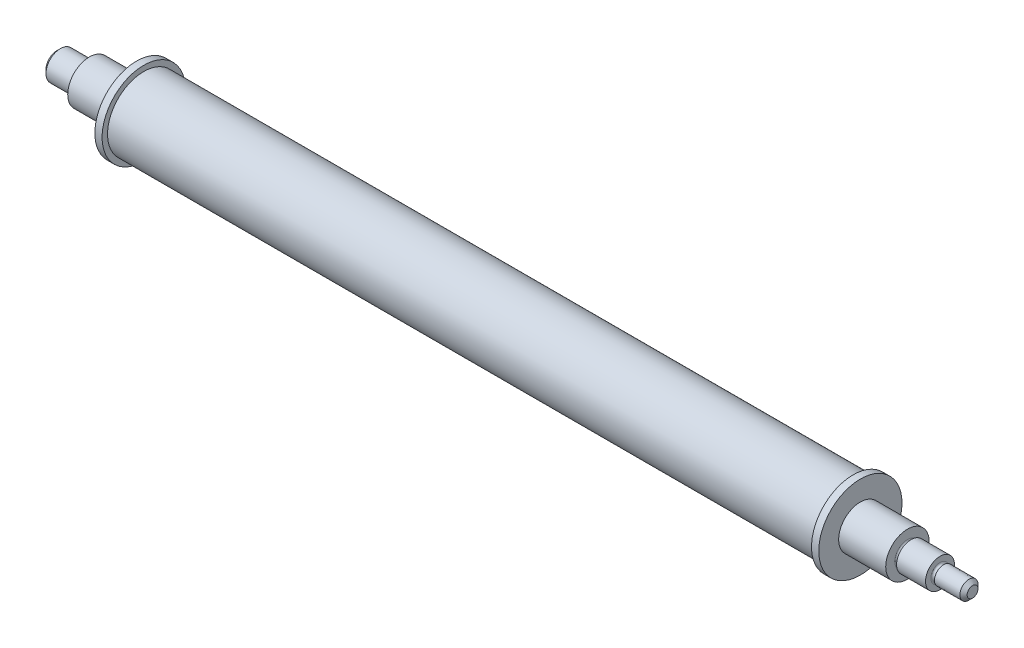
from build123d import *

# Parameters (mm, degrees)
SKETCH2_R           = 10
BOSS_EXTRUDE1_DEPTH = 98
SKETCH11_R          = 11.5
BOSS_EXTRUDE3_DEPTH = 2
CHAMFER2_SIZE       = 1
CHAMFER2_SIZE2      = 1.002948478
SKETCH15_R          = 2.523484115
CUT_EXTRUDE2_DEPTH  = 9
CHAMFER4_SIZE       = 1


with BuildPart() as part:
    # Sketch2 → Boss-Extrude1 (new body)
    with BuildSketch(Plane(origin=(0, 0, 0), x_dir=(0, 0, -1), z_dir=(1, 0, 0))):
        Circle(SKETCH2_R)
    extrude(amount=BOSS_EXTRUDE1_DEPTH)

    # Sketch11 → Boss-Extrude3 (add)
    with BuildSketch(Plane(origin=(98, 0, 0), x_dir=(0, 0, -1), z_dir=(1, 0, 0))):
        Circle(SKETCH11_R)
    extrude(amount=BOSS_EXTRUDE3_DEPTH)

    # Mirror3: part across plane


with BuildPart() as part_1:
    add(part.part)
    add(part.part.mirror(Plane(origin=(0, 0, 0), x_dir=(0, 0, 1), z_dir=(1, 0, 0))))

    # Sketch14 → Revolve1 (revolve)
    with BuildSketch(Plane.XY, mode=Mode.PRIVATE) as revolve1_sk:
        with BuildLine():
            Line((100, 6), (100, 0))
            Line((100, 0), (131, 0))
            Line((131, 0), (131, 2.5))
            Line((131, 2.5), (123, 2.523484115))
            ThreePointArc((123, 2.523484115), (122.853553391, 2.169930724), (122.5, 2.023484115))
            ThreePointArc((122.5, 2.023484115), (122.146446609, 2.169930724), (122, 2.523484115))
            Line((122, 2.523484115), (122, 3))
            Line((122, 3), (122, 4))
            Line((122, 4), (114.5, 4))
            Line((114.5, 4), (114, 4))
            Line((114, 4), (114, 3.5))
            ThreePointArc((114, 3.5), (113.853553391, 3.146446609), (113.5, 3))
            ThreePointArc((113.5, 3), (113.146446609, 3.146446609), (113, 3.5))
            Line((113, 3.5), (113, 6))
            Line((113, 6), (100, 6))
        make_face()
    revolve1 = revolve(revolve1_sk.sketch.rotate(Axis((0, 0, 0), (1, 0, 0)), 90), axis=Axis((0, 0, 0), (1, 0, 0)))

    # Chamfer2
    chamfer2_edges = [part_1.edges().sort_by_distance(p)[0] for p in [
        (131, 0, -2.5),
    ]]
    chamfer2_side = [part_1.faces().sort_by_distance(p)[0] for p in [
        (131, 0, 0),
    ]]
    chamfer(chamfer2_edges, length=CHAMFER2_SIZE, length2=CHAMFER2_SIZE2, reference=chamfer2_side[0])

    # Mirror6: Revolve1 across plane
    add(revolve1.mirror(Plane(origin=(0, 0, 0), x_dir=(0, 0, 1), z_dir=(1, 0, 0))))

    # Sketch15 → Cut-Extrude2 (cut)
    with BuildSketch(Plane.ZY.offset(131)):
        Circle(SKETCH15_R)
    extrude(amount=-CUT_EXTRUDE2_DEPTH, mode=Mode.SUBTRACT)

    # Chamfer4
    chamfer4_edges = [part_1.edges().sort_by_distance(p)[0] for p in [
        (-122, 0, -4),
    ]]
    chamfer(chamfer4_edges, length=CHAMFER4_SIZE)


solid = part_1.part
